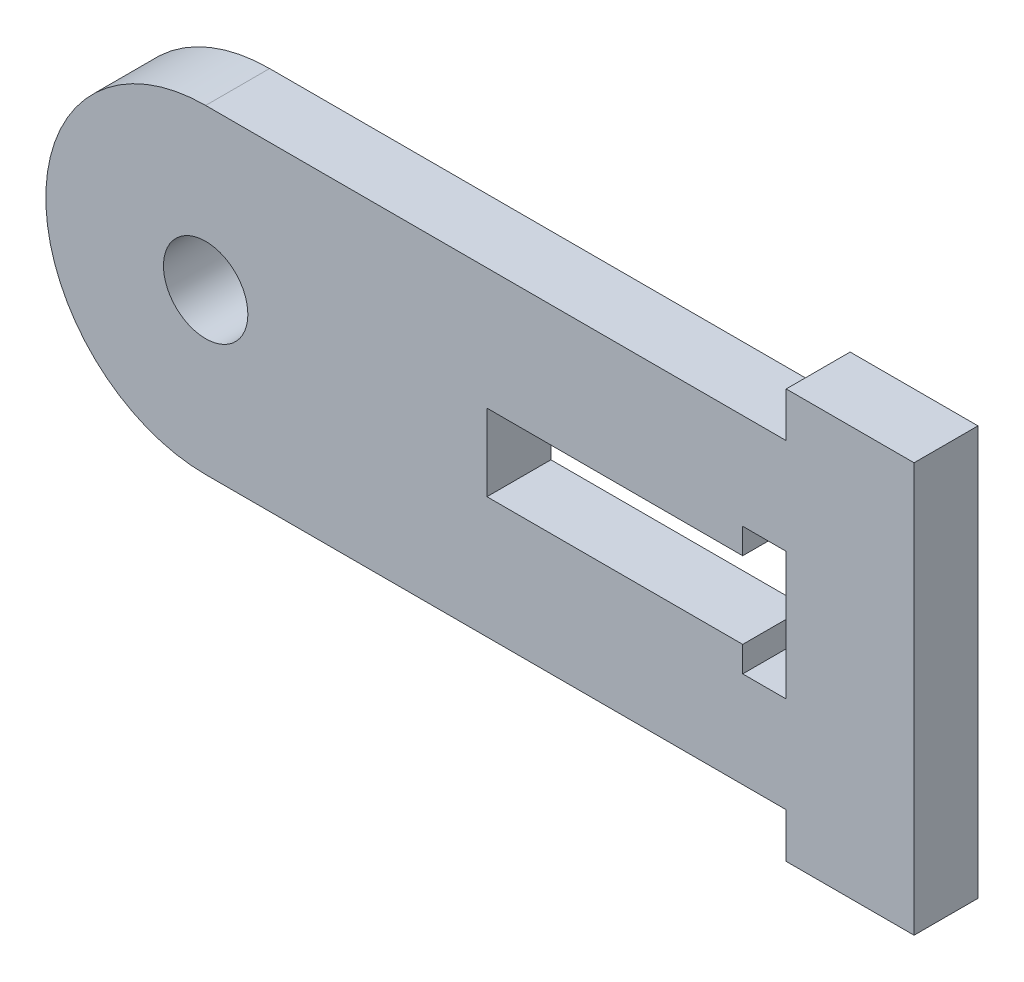
from build123d import *

# Parameters (mm, degrees)
SKETCH1_R           = 1.65
SKETCH1_W           = 10
SKETCH1_H           = 12.5
BOSS_EXTRUDE1_DEPTH = 2.5
SKETCH2_W           = 5
SKETCH2_H           = 16
BOSS_EXTRUDE2_DEPTH = 2.5
SKETCH3_W           = 1.7
SKETCH3_H           = 5
CUT_EXTRUDE1_DEPTH  = 29.940283343
SKETCH5_W           = 10
SKETCH5_H           = 3
CUT_EXTRUDE2_DEPTH  = 29.940283343


with BuildPart() as part:
    # Sketch1 → Boss-Extrude1 (new body)
    # profile 1 of 2: a face of its own
    with BuildSketch(Plane.XY):
        with BuildLine():
            ThreePointArc((0, 6.25), (-6.25, 0), (0, -6.25))
            Line((0, -6.25), (12.7, -6.25))
            Line((12.7, -6.25), (12.7, 6.25))
            Line((12.7, 6.25), (0, 6.25))
        make_face()
        Circle(SKETCH1_R, mode=Mode.SUBTRACT)
    # profile 2 of 2: a face of its own
    with BuildSketch(Plane.XY):
        with Locations((17.7, 0)):
            Rectangle(SKETCH1_W, SKETCH1_H)
    extrude(amount=BOSS_EXTRUDE1_DEPTH)

    # Sketch2 → Boss-Extrude2 (add)
    with BuildSketch(Plane.XY.offset(2.5)):
        with Locations((25.2, 0)):
            Rectangle(SKETCH2_W, SKETCH2_H)
    extrude(amount=-BOSS_EXTRUDE2_DEPTH)

    # Sketch3 → Cut-Extrude1 (cut, through all)
    with BuildSketch(Plane.XY.offset(2.5)):
        with Locations((21.85, 0)):
            Rectangle(SKETCH3_W, SKETCH3_H)
    extrude(amount=-CUT_EXTRUDE1_DEPTH, mode=Mode.SUBTRACT)

    # Sketch5 → Cut-Extrude2 (cut, through all)
    with BuildSketch(Plane.XY.offset(2.5)):
        with Locations((16, 0)):
            Rectangle(SKETCH5_W, SKETCH5_H)
    extrude(amount=-CUT_EXTRUDE2_DEPTH, mode=Mode.SUBTRACT)


solid = part.part
